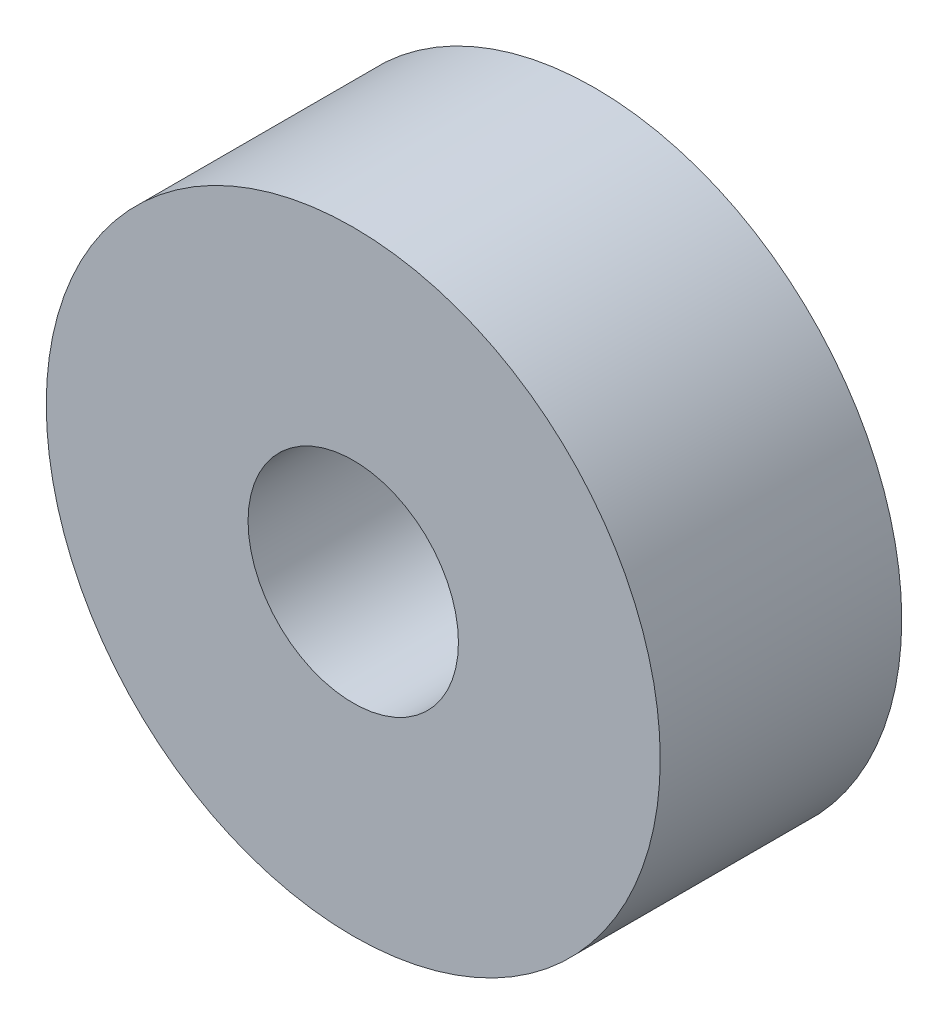
from build123d import *

# Parameters (mm, degrees)
SKETCH1_W = 7.493
SKETCH1_H = 6.2611


with BuildPart() as part:
    # Sketch1 → Revolve1 (revolve)
    with BuildSketch(Plane(origin=(0, 0, 0), x_dir=(0, 0, -1), z_dir=(1, 0, 0)), mode=Mode.PRIVATE) as revolve1_sk:
        with Locations((0, 6.39445)):
            Rectangle(SKETCH1_W, SKETCH1_H)
    revolve(revolve1_sk.sketch.rotate(Axis((0, 0, -21.730881676), (0, 0, 1)), 90), axis=Axis((0, 0, -21.730881676), (0, 0, 1)))


solid = part.part
